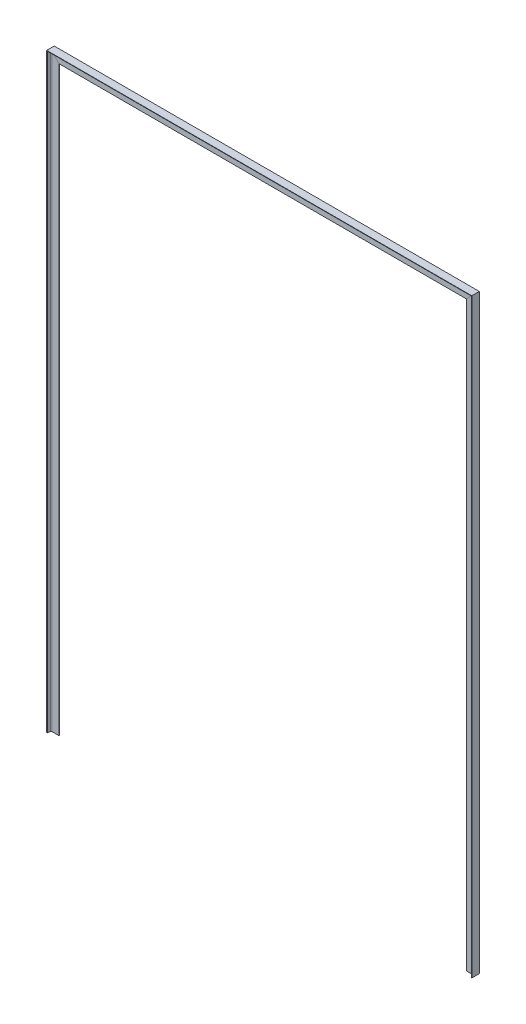
from build123d import *

# Parameters (mm, degrees)
ST_SECTION_ST6X17_5_1_DEPTH   = 10166.483526335
ST_SECTION_ST6X17_5_1_2_DEPTH = 7332.967052671
ST_SECTION_ST6X17_5_1_3_DEPTH = 10166.483526336


with BuildPart() as part:
    # Sketch11 → St section ST6X17.5(1) (new body)
    with BuildSketch(Plane(origin=(0, 0, 0), x_dir=(0, 0, -1), z_dir=(0, 1, 0))):
        with BuildLine():
            Line((-64.4906, 152.4), (64.4906, 152.4))
            Line((64.4906, 152.4), (64.4906, 147.996286207))
            ThreePointArc((64.4906, 147.996286207), (63.226568979, 144.548546584), (60.033566439, 142.734871391))
            Line((60.033566439, 142.734871391), (14.986386201, 135.22646032))
            ThreePointArc((14.986386201, 135.22646032), (8.144237901, 131.340013477), (5.4356, 123.952))
            Line((5.4356, 123.952), (5.4356, 0))
            Line((5.4356, 0), (-5.4356, 0))
            Line((-5.4356, 0), (-5.4356, 123.952))
            ThreePointArc((-5.4356, 123.952), (-8.144237901, 131.340013477), (-14.986386201, 135.22646032))
            Line((-14.986386201, 135.22646032), (-60.033566439, 142.734871391))
            ThreePointArc((-60.033566439, 142.734871391), (-63.226568979, 144.548546584), (-64.4906, 147.996286207))
            Line((-64.4906, 147.996286207), (-64.4906, 152.4))
        make_face()
    extrude(amount=ST_SECTION_ST6X17_5_1_DEPTH)

    # St section ST6X17.5(1) mitre 1
    split(bisect_by=Plane(origin=(0, 10000, 0), x_dir=(0.707106781, -0.707106781, 0), z_dir=(-0.707106781, -0.707106781, 0)), keep=Keep.TOP)


with BuildPart() as body_2:
    # Sketch11 on segment 2 (carried to segment 2) → St section ST6X17.5_1 2 (new body)
    with BuildSketch(Plane(origin=(-166.483526335, 10000, 0), x_dir=(0, 0, -1), z_dir=(1, 0, 0))):
        with BuildLine():
            Line((-64.4906, 152.4), (64.4906, 152.4))
            Line((64.4906, 152.4), (64.4906, 147.996286207))
            ThreePointArc((64.4906, 147.996286207), (63.226568979, 144.548546584), (60.033566439, 142.734871391))
            Line((60.033566439, 142.734871391), (14.986386201, 135.22646032))
            ThreePointArc((14.986386201, 135.22646032), (8.144237901, 131.340013477), (5.4356, 123.952))
            Line((5.4356, 123.952), (5.4356, 0))
            Line((5.4356, 0), (-5.4356, 0))
            Line((-5.4356, 0), (-5.4356, 123.952))
            ThreePointArc((-5.4356, 123.952), (-8.144237901, 131.340013477), (-14.986386201, 135.22646032))
            Line((-14.986386201, 135.22646032), (-60.033566439, 142.734871391))
            ThreePointArc((-60.033566439, 142.734871391), (-63.226568979, 144.548546584), (-64.4906, 147.996286207))
            Line((-64.4906, 147.996286207), (-64.4906, 152.4))
        make_face()
    extrude(amount=ST_SECTION_ST6X17_5_1_2_DEPTH)

    # St section ST6X17.5_1 2 mitre 1
    split(bisect_by=Plane(origin=(0, 10000, 0), x_dir=(-0.707106781, 0.707106781, 0), z_dir=(0.707106781, 0.707106781, 0)), keep=Keep.TOP)

    # St section ST6X17.5_1 2 mitre 2
    split(bisect_by=Plane(origin=(7000, 10000, 0), x_dir=(-0.707106781, -0.707106781, 0), z_dir=(-0.707106781, 0.707106781, 0)), keep=Keep.TOP)


with BuildPart() as body_3:
    # Sketch11 on segment 3 (carried to segment 3) → St section ST6X17.5_1 3 (new body)
    with BuildSketch(Plane(origin=(7000, 10166.483526335, 0), x_dir=(0, 0, -1), z_dir=(0, -1, 0))):
        with BuildLine():
            Line((-64.4906, 152.4), (64.4906, 152.4))
            Line((64.4906, 152.4), (64.4906, 147.996286207))
            ThreePointArc((64.4906, 147.996286207), (63.226568979, 144.548546584), (60.033566439, 142.734871391))
            Line((60.033566439, 142.734871391), (14.986386201, 135.22646032))
            ThreePointArc((14.986386201, 135.22646032), (8.144237901, 131.340013477), (5.4356, 123.952))
            Line((5.4356, 123.952), (5.4356, 0))
            Line((5.4356, 0), (-5.4356, 0))
            Line((-5.4356, 0), (-5.4356, 123.952))
            ThreePointArc((-5.4356, 123.952), (-8.144237901, 131.340013477), (-14.986386201, 135.22646032))
            Line((-14.986386201, 135.22646032), (-60.033566439, 142.734871391))
            ThreePointArc((-60.033566439, 142.734871391), (-63.226568979, 144.548546584), (-64.4906, 147.996286207))
            Line((-64.4906, 147.996286207), (-64.4906, 152.4))
        make_face()
    extrude(amount=ST_SECTION_ST6X17_5_1_3_DEPTH)

    # St section ST6X17.5_1 3 mitre 1
    split(bisect_by=Plane(origin=(7000, 10000, 0), x_dir=(0.707106781, 0.707106781, 0), z_dir=(0.707106781, -0.707106781, 0)), keep=Keep.TOP)


solid = Compound([part.part, body_2.part, body_3.part])
